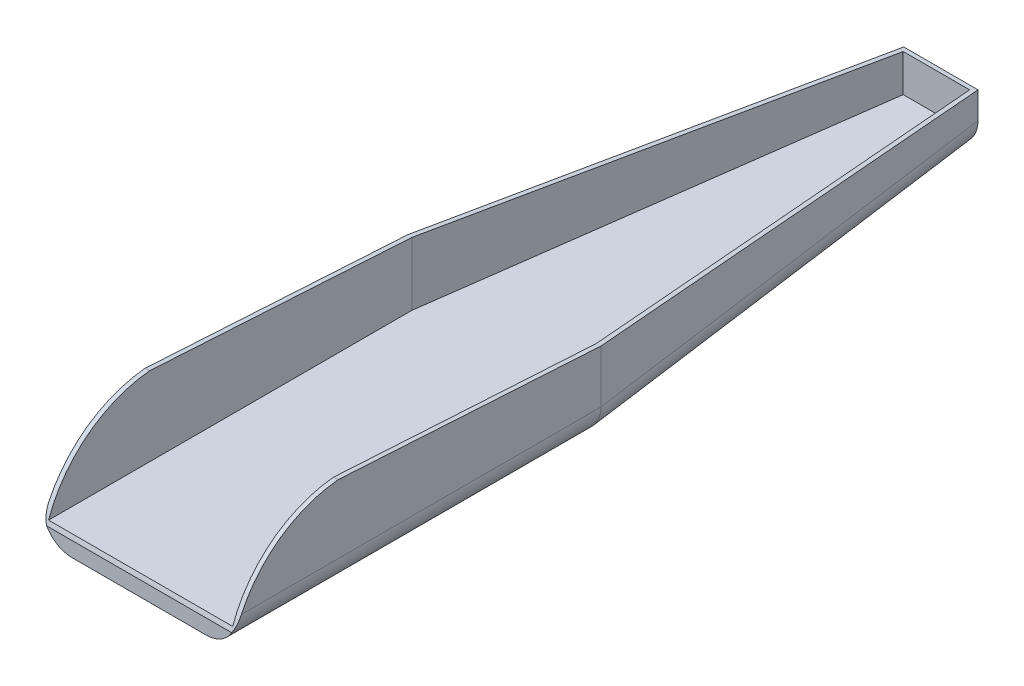
from build123d import *

# Parameters (mm, degrees)
BOSS_EXTRUDE1_DEPTH     = 65
CUT_EXTRUDE1_DEPTH      = 183.971935996
CUT_EXTRUDE1_DEPTH_BACK = 183.971935996
CUT_EXTRUDE2_DEPTH      = 183.971935996
CUT_EXTRUDE2_DEPTH_BACK = 183.971935996
SHELL2_T                = -1.5
BOSS_EXTRUDE4_DEPTH     = 5
FILLET12_R              = 10


with BuildPart() as part:
    # Sketch1 → Boss-Extrude1 (new body)
    with BuildSketch(Plane(origin=(0, 0, 0), x_dir=(0, 0, -1), z_dir=(1, 0, 0))):
        with BuildLine():
            Line((-101.278568247, 0), (168.721431753, 0))
            Line((168.721431753, 0), (168.721431753, 14))
            Line((168.721431753, 14), (-66.798599974, 28.050095))
            ThreePointArc((-66.798599974, 28.050095), (-88.293376402, 19.255158243), (-101.278568247, 0))
        make_face()
    extrude(amount=BOSS_EXTRUDE1_DEPTH)

    # Sketch3 → Cut-Extrude1 (cut, two sides: drawn at the far end of the back side and taken through both)
    with BuildSketch(Plane.XZ.offset(-CUT_EXTRUDE1_DEPTH_BACK)):
        Polygon((-75.150987408, 530.638325694), (0, -21.721431753), (20, -168.721431753), (95.150987408, -721.081189199), (-1009.568527485, -871.383164014), (-1179.8705023, 380.336350878), align=None)
    extrude(amount=CUT_EXTRUDE1_DEPTH + CUT_EXTRUDE1_DEPTH_BACK, mode=Mode.SUBTRACT)

    # Sketch5 → Cut-Extrude2 (cut, two sides: drawn at the far end of the back side and taken through both)
    with BuildSketch(Plane.XZ.offset(-CUT_EXTRUDE2_DEPTH_BACK)):
        Polygon((140.150987408, 530.638325694), (65, -21.721431753), (45, -168.721431753), (-30.150987408, -721.081189199), (1074.568527485, -871.383164014), (1244.8705023, 380.336350878), align=None)
    extrude(amount=CUT_EXTRUDE2_DEPTH + CUT_EXTRUDE2_DEPTH_BACK, mode=Mode.SUBTRACT)

    # Shell2
    shell2_openings = [part.faces().sort_by_distance(p)[0] for p in [
        (32.5, 22.000053007, -34.617517295),
        (32.5, 19.255158243, 88.293376402),
    ]]
    offset(amount=SHELL2_T, openings=shell2_openings, kind=Kind.INTERSECTION)

    # Sketch18 → Boss-Extrude4 (add)
    with BuildSketch(Plane.XZ):
        Polygon((65, 101.278568247), (0, 101.278568247), (0, -21.721431753), (20, -168.721431753), (45, -168.721431753), (65, -21.721431753), align=None)
    extrude(amount=BOSS_EXTRUDE4_DEPTH)

    # Fillet12
    fillet12_edges = [part.edges().sort_by_distance(p)[0] for p in [
        (65, -5, 39.778568247),
        (0, -5, 39.778568247),
        (10, -5, -95.221431753),
        (55, -5, -95.221431753),
    ]]
    fillet(fillet12_edges, radius=FILLET12_R)


solid = part.part
